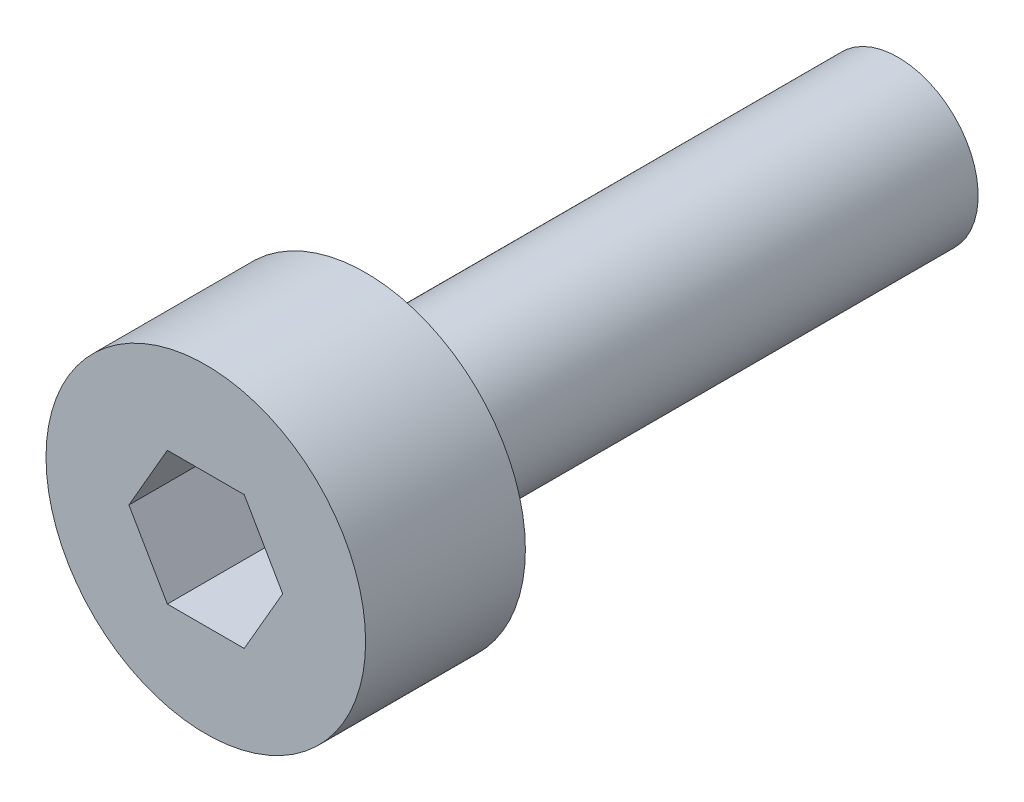
from build123d import *

# Parameters (mm, degrees)
SKETCH_5_R          = 3
EXTRUDE_1_DEPTH     = 3
CUT_EXTRUDE_1_DEPTH = 2
SKETCH_7_R          = 1.5
EXTRUDE_2_DEPTH     = 10


with BuildPart() as part:
    # ｽｹｯﾁ5 → ﾎﾞｽ - 押し出し1 (new body)
    with BuildSketch(Plane.XY):
        Circle(SKETCH_5_R)
    extrude(amount=EXTRUDE_1_DEPTH)

    # ｽｹｯﾁ6 → ｶｯﾄ - 押し出し1 (cut)
    with BuildSketch(Plane.XY.offset(3)):
        Polygon((1.443375673, 0), (0.721687836, 1.25), (-0.721687836, 1.25), (-1.443375673, 0), (-0.721687836, -1.25), (0.721687836, -1.25), align=None)
    extrude(amount=-CUT_EXTRUDE_1_DEPTH, mode=Mode.SUBTRACT)

    # ｽｹｯﾁ7 → ﾎﾞｽ - 押し出し2 (add)
    with BuildSketch(Plane(origin=(0, 0, 0), x_dir=(-1, 0, 0), z_dir=(0, 0, -1))):
        Circle(SKETCH_7_R)
    extrude(amount=EXTRUDE_2_DEPTH)


solid = part.part
